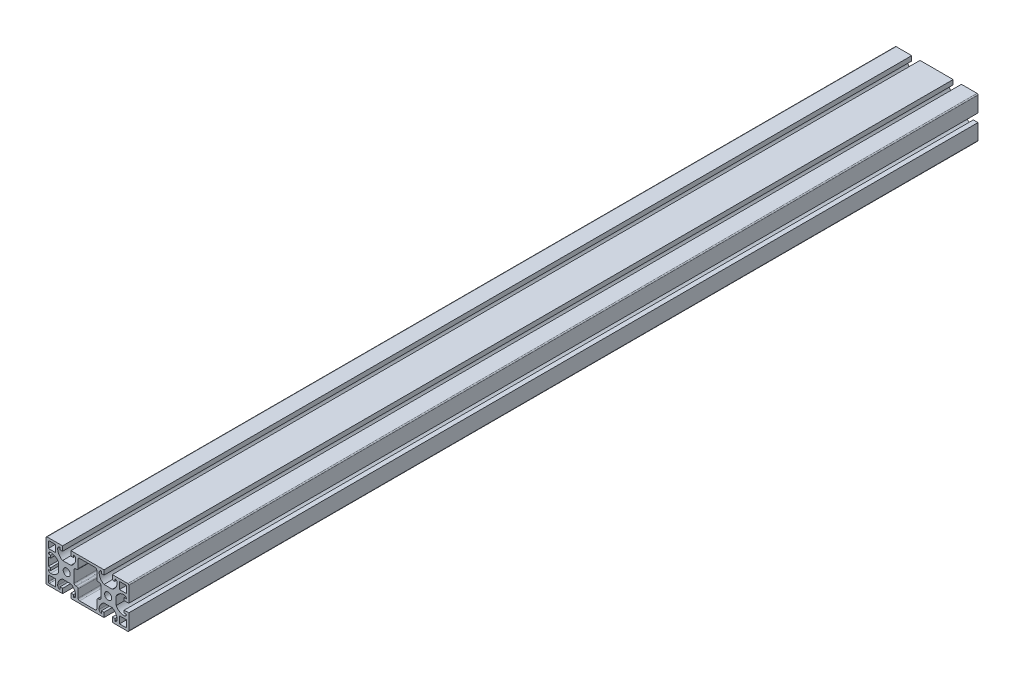
from build123d import *

# Parameters (mm, degrees)
SZKIC1_R                    = 3.4
DODANIE_WYCI_GNI_CIE1_DEPTH = 820


with BuildPart() as part:
    # Szkic1 → Dodanie-wyciągnięcie1 (new body)
    with BuildSketch(Plane.XY):
        with BuildLine():
            Line((-40, -19), (-40, 19))
            ThreePointArc((-40, 19), (-39.707106781, 19.707106781), (-39, 20))
            Line((-39, 20), (-24, 20))
            Line((-24, 20), (-24, 15.5))
            Line((-24, 15.5), (-26.471381771, 15.5))
            Line((-26.471381771, 15.5), (-26.471381771, 17.75))
            ThreePointArc((-26.471381771, 17.75), (-28.062372029, 17.090990258), (-28.721381771, 15.5))
            ThreePointArc((-28.721381771, 15.5), (-27.448087912, 10.962546258), (-24, 7.75))
            Line((-24, 7.75), (-16, 7.75))
            ThreePointArc((-16, 7.75), (-12.551912088, 10.962546258), (-11.278618229, 15.5))
            ThreePointArc((-11.278618229, 15.5), (-11.937627971, 17.090990258), (-13.528618229, 17.75))
            Line((-13.528618229, 17.75), (-13.528618229, 15.5))
            Line((-13.528618229, 15.5), (-16, 15.5))
            Line((-16, 15.5), (-16, 20))
            Line((-16, 20), (13.528618229, 20))
            Line((13.528618229, 20), (16, 20))
            Line((16, 20), (16, 15.5))
            Line((16, 15.5), (13.528618229, 15.5))
            Line((13.528618229, 15.5), (13.528618229, 17.75))
            ThreePointArc((13.528618229, 17.75), (11.937627971, 17.090990258), (11.278618229, 15.5))
            ThreePointArc((11.278618229, 15.5), (12.551912088, 10.962546258), (16, 7.75))
            Line((16, 7.75), (24, 7.75))
            ThreePointArc((24, 7.75), (27.448087912, 10.962546258), (28.721381771, 15.5))
            ThreePointArc((28.721381771, 15.5), (28.062372029, 17.090990258), (26.471381771, 17.75))
            Line((26.471381771, 17.75), (26.471381771, 15.5))
            Line((26.471381771, 15.5), (24, 15.5))
            Line((24, 15.5), (24, 20))
            Line((24, 20), (39, 20))
            ThreePointArc((39, 20), (39.707106781, 19.707106781), (40, 19))
            Line((40, 19), (40, 4))
            Line((40, 4), (35.5, 4))
            Line((35.5, 4), (35.5, 6.471381771))
            Line((35.5, 6.471381771), (37.75, 6.471381771))
            ThreePointArc((37.75, 6.471381771), (37.090990258, 8.062372029), (35.5, 8.721381771))
            ThreePointArc((35.5, 8.721381771), (30.962546258, 7.448087912), (27.75, 4))
            Line((27.75, 4), (27.75, -4))
            ThreePointArc((27.75, -4), (30.962546258, -7.448087912), (35.5, -8.721381771))
            ThreePointArc((35.5, -8.721381771), (37.090990258, -8.062372029), (37.75, -6.471381771))
            Line((37.75, -6.471381771), (35.5, -6.471381771))
            Line((35.5, -6.471381771), (35.5, -4))
            Line((35.5, -4), (40, -4))
            Line((40, -4), (40, -19))
            ThreePointArc((40, -19), (39.707106781, -19.707106781), (39, -20))
            Line((39, -20), (24, -20))
            Line((24, -20), (24, -15.5))
            Line((24, -15.5), (26.471381771, -15.5))
            Line((26.471381771, -15.5), (26.471381771, -17.75))
            ThreePointArc((26.471381771, -17.75), (28.062372029, -17.090990258), (28.721381771, -15.5))
            ThreePointArc((28.721381771, -15.5), (27.448087912, -10.962546258), (24, -7.75))
            Line((24, -7.75), (16, -7.75))
            ThreePointArc((16, -7.75), (12.551912088, -10.962546258), (11.278618229, -15.5))
            ThreePointArc((11.278618229, -15.5), (11.937627971, -17.090990258), (13.528618229, -17.75))
            Line((13.528618229, -17.75), (13.528618229, -15.5))
            Line((13.528618229, -15.5), (16, -15.5))
            Line((16, -15.5), (16, -20))
            Line((16, -20), (-16, -20))
            Line((-16, -20), (-16, -15.5))
            Line((-16, -15.5), (-13.528618229, -15.5))
            Line((-13.528618229, -15.5), (-13.528618229, -17.75))
            ThreePointArc((-13.528618229, -17.75), (-11.937627971, -17.090990258), (-11.278618229, -15.5))
            ThreePointArc((-11.278618229, -15.5), (-12.551912088, -10.962546258), (-16, -7.75))
            Line((-16, -7.75), (-24, -7.75))
            ThreePointArc((-24, -7.75), (-27.448087912, -10.962546258), (-28.721381771, -15.5))
            ThreePointArc((-28.721381771, -15.5), (-28.062372029, -17.090990258), (-26.471381771, -17.75))
            Line((-26.471381771, -17.75), (-26.471381771, -15.5))
            Line((-26.471381771, -15.5), (-24, -15.5))
            Line((-24, -15.5), (-24, -20))
            Line((-24, -20), (-39, -20))
            ThreePointArc((-39, -20), (-39.707106781, -19.707106781), (-40, -19))
        make_face()
        with Locations(Location((-20, 0, 0), (0, 0, 180))):
            Circle(SZKIC1_R, mode=Mode.SUBTRACT)
        with Locations(Location((20, 0, 0), (0, 0, 180))):
            Circle(SZKIC1_R, mode=Mode.SUBTRACT)
        with BuildLine():
            Line((30.971381771, -17.75), (36.75, -17.75))
            ThreePointArc((36.75, -17.75), (37.457106781, -17.457106781), (37.75, -16.75))
            Line((37.75, -16.75), (37.75, -10.971381771))
            Line((37.75, -10.971381771), (30.971381771, -10.971381771))
            Line((30.971381771, -10.971381771), (30.971381771, -17.75))
        make_face(mode=Mode.SUBTRACT)
        with BuildLine():
            Line((-35.5, -6.471381771), (-37.75, -6.471381771))
            ThreePointArc((-37.75, -6.471381771), (-37.090990258, -8.062372029), (-35.5, -8.721381771))
            ThreePointArc((-35.5, -8.721381771), (-30.962546258, -7.448087912), (-27.75, -4))
            Line((-27.75, -4), (-27.75, 4))
            ThreePointArc((-27.75, 4), (-30.962546258, 7.448087912), (-35.5, 8.721381771))
            ThreePointArc((-35.5, 8.721381771), (-37.090990258, 8.062372029), (-37.75, 6.471381771))
            Line((-37.75, 6.471381771), (-35.5, 6.471381771))
            Line((-35.5, 6.471381771), (-35.5, 4))
            Line((-35.5, 4), (-37.75, 4))
            Line((-37.75, 4), (-37.75, -4))
            Line((-37.75, -4), (-35.5, -4))
            Line((-35.5, -4), (-35.5, -6.471381771))
        make_face(mode=Mode.SUBTRACT)
        with BuildLine():
            Line((10.528618229, 7.090188806), (11.40950808, 7.090188806))
            ThreePointArc((11.40950808, 7.090188806), (12.470168251, 6.650848977), (12.90950808, 5.590188806))
            Line((12.90950808, 5.590188806), (12.90950808, -5.590188806))
            ThreePointArc((12.90950808, -5.590188806), (12.470168251, -6.650848977), (11.40950808, -7.090188806))
            Line((11.40950808, -7.090188806), (10.528618229, -7.090188806))
            ThreePointArc((10.528618229, -7.090188806), (9.467958057, -7.529528634), (9.028618229, -8.590188806))
            Line((9.028618229, -8.590188806), (9.028618229, -16.25))
            ThreePointArc((9.028618229, -16.25), (8.589278401, -17.310660172), (7.528618229, -17.75))
            Line((7.528618229, -17.75), (-7.528618229, -17.75))
            ThreePointArc((-7.528618229, -17.75), (-8.589278401, -17.310660172), (-9.028618229, -16.25))
            Line((-9.028618229, -16.25), (-9.028618229, -8.590188806))
            ThreePointArc((-9.028618229, -8.590188806), (-9.467958057, -7.529528634), (-10.528618229, -7.090188806))
            Line((-10.528618229, -7.090188806), (-11.40950808, -7.090188806))
            ThreePointArc((-11.40950808, -7.090188806), (-12.470168251, -6.650848977), (-12.90950808, -5.590188806))
            Line((-12.90950808, -5.590188806), (-12.90950808, 5.590188806))
            ThreePointArc((-12.90950808, 5.590188806), (-12.470168251, 6.650848977), (-11.40950808, 7.090188806))
            Line((-11.40950808, 7.090188806), (-10.528618229, 7.090188806))
            ThreePointArc((-10.528618229, 7.090188806), (-9.467958057, 7.529528634), (-9.028618229, 8.590188806))
            Line((-9.028618229, 8.590188806), (-9.028618229, 16.25))
            ThreePointArc((-9.028618229, 16.25), (-8.589278401, 17.310660172), (-7.528618229, 17.75))
            Line((-7.528618229, 17.75), (7.528618229, 17.75))
            ThreePointArc((7.528618229, 17.75), (8.589278401, 17.310660172), (9.028618229, 16.25))
            Line((9.028618229, 16.25), (9.028618229, 8.590188806))
            ThreePointArc((9.028618229, 8.590188806), (9.467958057, 7.529528634), (10.528618229, 7.090188806))
        make_face(mode=Mode.SUBTRACT)
        with BuildLine():
            Line((30.971381771, 10.971381771), (37.75, 10.971381771))
            Line((37.75, 10.971381771), (37.75, 16.75))
            ThreePointArc((37.75, 16.75), (37.457106781, 17.457106781), (36.75, 17.75))
            Line((36.75, 17.75), (30.971381771, 17.75))
            Line((30.971381771, 17.75), (30.971381771, 10.971381771))
        make_face(mode=Mode.SUBTRACT)
        with BuildLine():
            Line((-30.971381771, -10.971381771), (-30.971381771, -17.75))
            Line((-30.971381771, -17.75), (-36.75, -17.75))
            ThreePointArc((-36.75, -17.75), (-37.457106781, -17.457106781), (-37.75, -16.75))
            Line((-37.75, -16.75), (-37.75, -10.971381771))
            Line((-37.75, -10.971381771), (-30.971381771, -10.971381771))
        make_face(mode=Mode.SUBTRACT)
        with BuildLine():
            Line((-30.971381771, 17.75), (-36.75, 17.75))
            ThreePointArc((-36.75, 17.75), (-37.457106781, 17.457106781), (-37.75, 16.75))
            Line((-37.75, 16.75), (-37.75, 10.971381771))
            Line((-37.75, 10.971381771), (-30.971381771, 10.971381771))
            Line((-30.971381771, 10.971381771), (-30.971381771, 17.75))
        make_face(mode=Mode.SUBTRACT)
    extrude(amount=DODANIE_WYCI_GNI_CIE1_DEPTH)


solid = part.part
